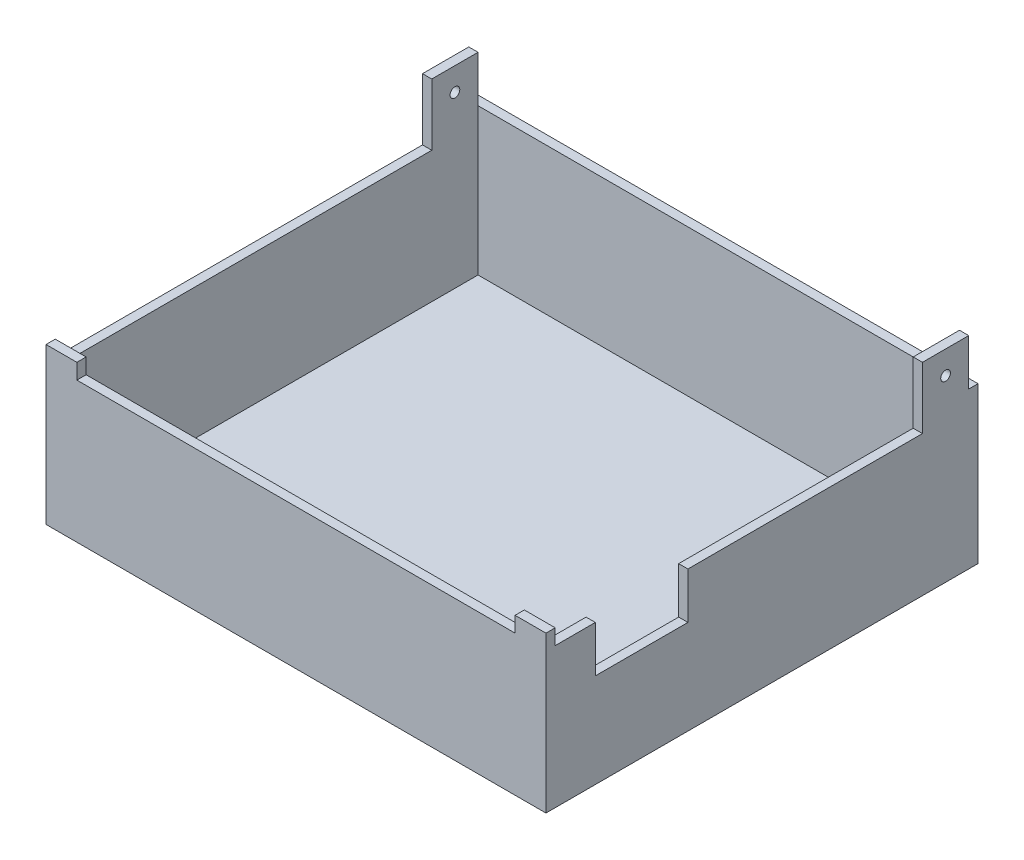
from build123d import *

# Parameters (mm, degrees)
SKETCH1_W           = 162
SKETCH1_H           = 140
BOSS_EXTRUDE2_DEPTH = 3
SKETCH2_W           = 162
SKETCH2_H           = 140
SKETCH2_W_2         = 156
SKETCH2_H_2         = 134
BOSS_EXTRUDE3_DEPTH = 47.5
SKETCH4_W           = 3
SKETCH4_H           = 134
BOSS_EXTRUDE4_DEPTH = 15
SKETCH5_R           = 1.575
SKETCH5_W           = 119
SKETCH5_H           = 20
CUT_EXTRUDE3_DEPTH  = 189.239873566
CUT_EXTRUDE4_REACH  = 176.503
SKETCH9_W           = 142
SKETCH9_H           = 5
CUT_EXTRUDE5_REACH  = 190.24
SKETCH10_W          = 30
SKETCH10_H          = 15


with BuildPart() as part:
    # Sketch1 → Boss-Extrude2 (new body)
    with BuildSketch(Plane(origin=(0, 0, 0), x_dir=(1, 0, 0), z_dir=(0, 1, 0))):
        Rectangle(SKETCH1_W, SKETCH1_H)
    extrude(amount=BOSS_EXTRUDE2_DEPTH)

    # Sketch2 → Boss-Extrude3 (add)
    with BuildSketch(Plane(origin=(0, 3, 0), x_dir=(1, 0, 0), z_dir=(0, 1, 0))):
        Rectangle(SKETCH2_W, SKETCH2_H)
        Rectangle(SKETCH2_W_2, SKETCH2_H_2, mode=Mode.SUBTRACT)
    extrude(amount=BOSS_EXTRUDE3_DEPTH)

    # Sketch4 → Boss-Extrude4 (add)
    with BuildSketch(Plane(origin=(0, 50.5, 0), x_dir=(1, 0, 0), z_dir=(0, 1, 0))):
        with Locations((-79.5, 0)):
            Rectangle(SKETCH4_W, SKETCH4_H)
        with Locations((79.5, 0)):
            Rectangle(SKETCH4_W, SKETCH4_H)
    extrude(amount=BOSS_EXTRUDE4_DEPTH)

    # Sketch5 → Cut-Extrude3 (cut, through all)
    with BuildSketch(Plane(origin=(81, 0, 0), x_dir=(0, 0, -1), z_dir=(1, 0, 0))):
        with Locations((59.5, 58)):
            Circle(SKETCH5_R)
        with Locations((-7.5, 55.5)):
            Rectangle(SKETCH5_W, SKETCH5_H)
    extrude(amount=-CUT_EXTRUDE3_DEPTH, mode=Mode.SUBTRACT)

    # Sketch9 → Cut-Extrude4 (cut, up to next)
    with BuildSketch(Plane.XY.offset(70), mode=Mode.PRIVATE) as cut_extrude4_sk1:
        with Locations((0, 48)):
            Rectangle(SKETCH9_W, SKETCH9_H)
    cut_extrude4_tool1 = extrude(cut_extrude4_sk1.sketch, amount=-CUT_EXTRUDE4_REACH, mode=Mode.PRIVATE) & part.part
    add(cut_extrude4_tool1.solids().sort_by_distance((0, 48, 70))[0], mode=Mode.SUBTRACT)

    # Sketch10 → Cut-Extrude5 (cut, up to next)
    with BuildSketch(Plane(origin=(81, 0, 0), x_dir=(0, 0, -1), z_dir=(1, 0, 0)), mode=Mode.PRIVATE) as cut_extrude5_sk1:
        with Locations((-39, 38)):
            Rectangle(SKETCH10_W, SKETCH10_H)
    cut_extrude5_tool1 = extrude(cut_extrude5_sk1.sketch, amount=-CUT_EXTRUDE5_REACH, mode=Mode.PRIVATE) & part.part
    add(cut_extrude5_tool1.solids().sort_by_distance((81, 38, 39))[0], mode=Mode.SUBTRACT)


solid = part.part
